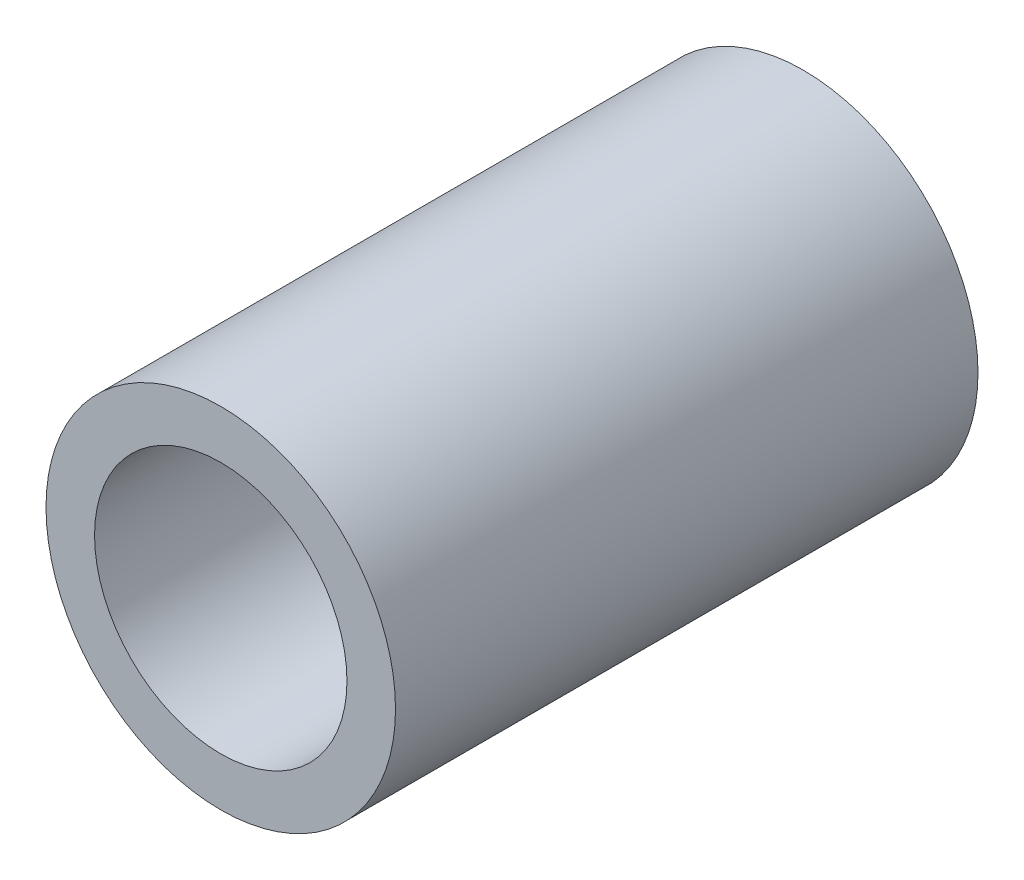
from build123d import *

# Parameters (mm, degrees)
CROQUIS1_R              = 4.5
CROQUIS1_R_2            = 3.25
SALIENTE_EXTRUIR1_DEPTH = 15


with BuildPart() as part:
    # Croquis1 → Saliente-Extruir1 (new body)
    with BuildSketch(Plane.XY):
        Circle(CROQUIS1_R)
        Circle(CROQUIS1_R_2, mode=Mode.SUBTRACT)
    extrude(amount=SALIENTE_EXTRUIR1_DEPTH)


solid = part.part
